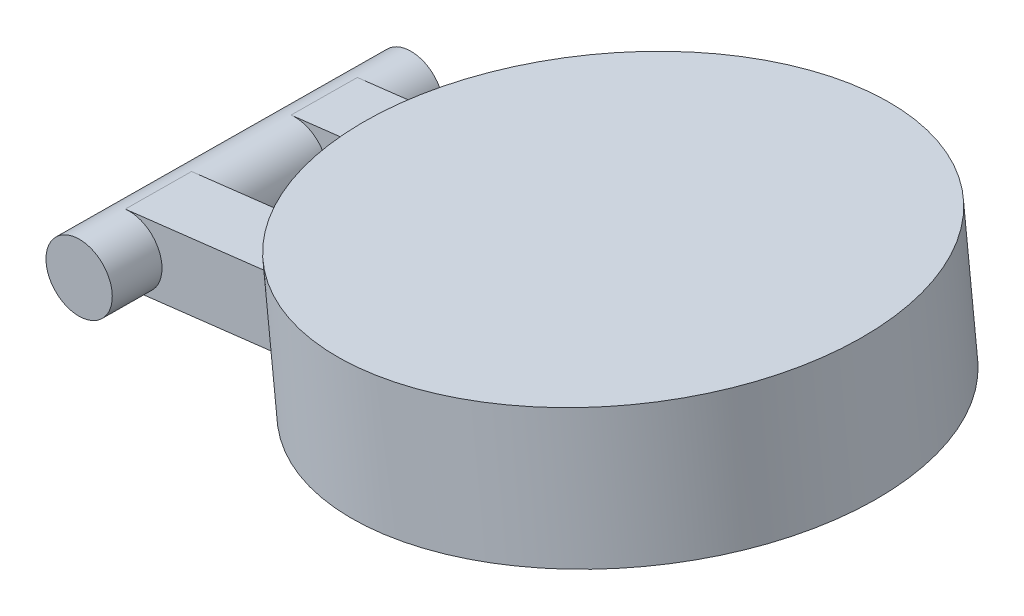
from build123d import *

# Parameters (mm, degrees)
CROQUIS1_R                   = 15.000000000000002
SALIENTE_EXTRUIR1_DEPTH      = 8
CROQUIS2_R                   = 4.000000000000007
CROQUIS2_R_2                 = 1.4999999999999973
CORTAR_EXTRUIR1_DEPTH        = 3
SALIENTE_EXTRUIR2_START      = -4
SALIENTE_EXTRUIR2_DEPTH      = 4
SALIENTE_EXTRUIR3_DEPTH      = 10
SALIENTE_EXTRUIR3_DEPTH_BACK = 10
CROQUIS4_R                   = 1.999999999999995
CORTAR_EXTRUIR2_DEPTH        = 26.000000000000004
CROQUIS6_R                   = 1.499999999999999
CORTAR_EXTRUIR3_DEPTH        = 0.5


with BuildPart() as part:
    # Croquis1 → Saliente-Extruir1 (new body)
    with BuildSketch(Plane(origin=(3.102503887066035, -26.412068884743757, 0.2313913751144545), x_dir=(0.9931720445250996, 0.11665438489091776, -0.0010219880408017562), z_dir=(0.11665886153153528, -0.9931339327669669, 0.008700667387268338))):
        with Locations(Location((-115.80198834358447, 158.9846336736222, 0), (0, 0, 0.058557828))):
            Circle(CROQUIS1_R)
    extrude(amount=SALIENTE_EXTRUIR1_DEPTH)

    # Croquis2 → Cortar-Extruir1 (cut)
    with BuildSketch(Plane(origin=(4.03577477931832, -34.35714034687951, 0.3009967142126015), x_dir=(0.9931720445250996, 0.11665438489091778, -0.0010219880408017569), z_dir=(0.1166588615315353, -0.9931339327669669, 0.00870066738726834))):
        with Locations(Location((-115.8019883435845, 158.9846336736222, 0), (0, 0, 0.058557828))):
            Circle(CROQUIS2_R)
        with Locations(Location((-115.8019883435845, 168.9846336736222, 0), (0, 0, 0.058557828))):
            Circle(CROQUIS2_R_2)
        with Locations(Location((-115.8019883435845, 148.9846336736222, 0), (0, 0, 0.058557828))):
            Circle(CROQUIS2_R_2)
    extrude(amount=-CORTAR_EXTRUIR1_DEPTH, mode=Mode.SUBTRACT)

    # Croquis3 → Saliente-Extruir2 (add)
    with BuildSketch(Plane(origin=(4.03577477931832, -34.35714034687951, 0.3009967142126015), x_dir=(0.9931720445250996, 0.11665438489091778, -0.0010219880408017569), z_dir=(0.1166588615315353, -0.9931339327669669, 0.00870066738726834)).offset(SALIENTE_EXTRUIR2_START)):
        with BuildLine():
            Line((-140.80198834358453, 161.9846336736222), (-130.49892680028356, 161.9846336736222))
            ThreePointArc((-130.49892680028356, 161.98463367362223), (-129.9260267482204, 164.03552855912218), (-129.06848750500595, 165.98463367362243))
            Line((-129.0684875050059, 165.9846336736222), (-140.80198834358453, 165.9846336736222))
            Line((-140.80198834358453, 165.9846336736222), (-140.80198834358453, 161.9846336736222))
        make_face()
        with BuildLine():
            ThreePointArc((-129.06848750500598, 151.98463367362197), (-129.9260267482204, 153.9337387881222), (-130.49892680028356, 155.98463367362217))
            Line((-130.49892680028356, 155.9846336736222), (-140.80198834358453, 155.9846336736222))
            Line((-140.80198834358453, 155.9846336736222), (-140.80198834358453, 151.9846336736222))
            Line((-140.80198834358453, 151.9846336736222), (-129.06848750500592, 151.9846336736222))
        make_face()
        with BuildLine():
            Line((-125.01691169330087, 151.9846336736222), (-125.01691169330087, 155.9846336736222))
            Line((-125.01691169330087, 155.9846336736222), (-130.49892680028356, 155.9846336736222))
            ThreePointArc((-130.49892680028356, 155.98463367362217), (-129.9260267482204, 153.9337387881222), (-129.06848750500598, 151.98463367362197))
            Line((-129.06848750500592, 151.9846336736222), (-125.01691169330087, 151.9846336736222))
        make_face()
        with BuildLine():
            Line((-130.49892680028356, 161.9846336736222), (-125.01691169330087, 161.9846336736222))
            Line((-125.01691169330087, 161.9846336736222), (-125.01691169330087, 165.9846336736222))
            Line((-125.01691169330087, 165.9846336736222), (-129.0684875050059, 165.9846336736222))
            ThreePointArc((-129.06848750500595, 165.98463367362243), (-129.9260267482204, 164.03552855912218), (-130.49892680028356, 161.98463367362223))
        make_face()
    extrude(amount=SALIENTE_EXTRUIR2_DEPTH)

    # Croquis4 → Saliente-Extruir3 (add, two sides: drawn at the far end of the back side and taken through both)
    with BuildSketch(Plane(origin=(-6.683e-14, 1.3927822726245929, 158.97853283345188), x_dir=(1, 0, 4.2e-16), z_dir=(0, 0.008760483579084877, 0.9999616262274571)).offset(-SALIENTE_EXTRUIR3_DEPTH_BACK)):
        with Locations(Location((-134.05179749109138, -48.5645966599886, 0), (0, 0, 276.699314902))):
            Circle(CROQUIS4_R)
    extrude(amount=SALIENTE_EXTRUIR3_DEPTH + SALIENTE_EXTRUIR3_DEPTH_BACK)

    # Croquis5 → Cortar-Extruir2 (cut)
    with BuildSketch(Plane(origin=(-7.073e-14, 1.4803871084154419, 168.97814909572648), x_dir=(1, 0, 4.2e-16), z_dir=(0, 0.008760483579084877, 0.9999616262274571))):
        Polygon((-137.1921048729679, -53.52505022011607), (-133.51980518703422, -53.09369867037679), (-133.8184797680283, -50.5509407490388), (-135.80482385707867, -50.78425847210188), (-136.03814158014168, -48.79791438305168), (-136.2714593032048, -46.81157029400149), (-134.28511521415442, -46.578252570938396), (-134.47954467160224, -44.922982673441965), (-138.15184435753594, -45.35433422318124), align=None)
        with BuildLine():
            ThreePointArc((-136.03814158014154, -48.79791438305167), (-135.62133541037747, -47.32501982900029), (-134.28511521415442, -46.57825257093841))
            Line((-134.28511521415442, -46.578252570938396), (-136.2714593032048, -46.81157029400149))
            Line((-136.2714593032048, -46.81157029400149), (-136.03814158014168, -48.79791438305168))
        make_face()
        with BuildLine():
            ThreePointArc((-133.8184797680283, -50.550940749038816), (-135.2913743220797, -50.13413457927471), (-136.03814158014154, -48.79791438305167))
            Line((-136.03814158014168, -48.79791438305168), (-135.80482385707867, -50.78425847210188))
            Line((-135.80482385707867, -50.78425847210188), (-133.8184797680283, -50.5509407490388))
        make_face()
    extrude(amount=-CORTAR_EXTRUIR2_DEPTH, mode=Mode.SUBTRACT)

    # Croquis6 → Cortar-Extruir3 (cut)
    # profile 1 of 2: a face of its own
    with BuildSketch(Plane(origin=(4.03577477931832, -34.35714034687951, 0.3009967142126015), x_dir=(0.9931720445250996, 0.11665438489091778, -0.0010219880408017569), z_dir=(0.1166588615315353, -0.9931339327669669, 0.008700667387268341))):
        with BuildLine():
            Line((-111.32985238858495, 159.4846336736222), (-101.81091976395129, 159.4846336736222))
            ThreePointArc((-101.81091976395126, 159.48463367362265), (-112.97131478814173, 172.6954792792921), (-128.45109898425804, 164.9846336736222))
            Line((-128.45109898425804, 164.9846336736222), (-137.80198834358436, 164.98463367362217))
            Line((-137.80198834358436, 164.98463367362217), (-137.80198834358436, 162.98463367362217))
            Line((-137.80198834358436, 162.98463367362217), (-129.21839620858324, 162.9846336736222))
            ThreePointArc((-129.21839620858324, 162.9846336736222), (-129.6170142670406, 161.25290586501285), (-129.7930569232177, 159.48463367362226))
            Line((-129.7930569232177, 159.4846336736222), (-120.27412429858411, 159.4846336736222))
            ThreePointArc((-120.27412429858411, 159.48463367362217), (-115.80198834358455, 163.4846336736222), (-111.32985238858495, 159.48463367362223))
        make_face()
        with Locations(Location((-115.80198834358454, 168.9846336736222, 0), (0, 0, 0.058557828))):
            Circle(CROQUIS6_R, mode=Mode.SUBTRACT)
    # profile 2 of 2: a face of its own
    with BuildSketch(Plane(origin=(4.03577477931832, -34.35714034687951, 0.3009967142126015), x_dir=(0.9931720445250996, 0.11665438489091778, -0.0010219880408017569), z_dir=(0.1166588615315353, -0.9931339327669669, 0.008700667387268341))):
        with BuildLine():
            ThreePointArc((-128.45109898425804, 152.9846336736222), (-112.97131478814173, 145.2737880679523), (-101.81091976395126, 158.48463367362174))
            Line((-101.81091976395128, 158.4846336736222), (-111.32985238858495, 158.4846336736222))
            ThreePointArc((-111.32985238858495, 158.48463367362217), (-115.80198834358455, 154.4846336736222), (-120.27412429858411, 158.48463367362223))
            Line((-120.27412429858411, 158.4846336736222), (-129.7930569232177, 158.4846336736222))
            ThreePointArc((-129.7930569232177, 158.48463367362214), (-129.6170142670406, 156.71636148223155), (-129.21839620858327, 154.98463367362223))
            Line((-129.21839620858327, 154.98463367362223), (-137.80198834358436, 154.9846336736222))
            Line((-137.80198834358436, 154.9846336736222), (-137.80198834358436, 152.9846336736222))
            Line((-137.80198834358436, 152.9846336736222), (-128.45109898425804, 152.9846336736222))
        make_face()
        with Locations(Location((-115.80198834358453, 148.9846336736222, 0), (0, 0, 0.058557828))):
            Circle(CROQUIS6_R, mode=Mode.SUBTRACT)
    extrude(amount=-CORTAR_EXTRUIR3_DEPTH, mode=Mode.SUBTRACT)


solid = part.part
